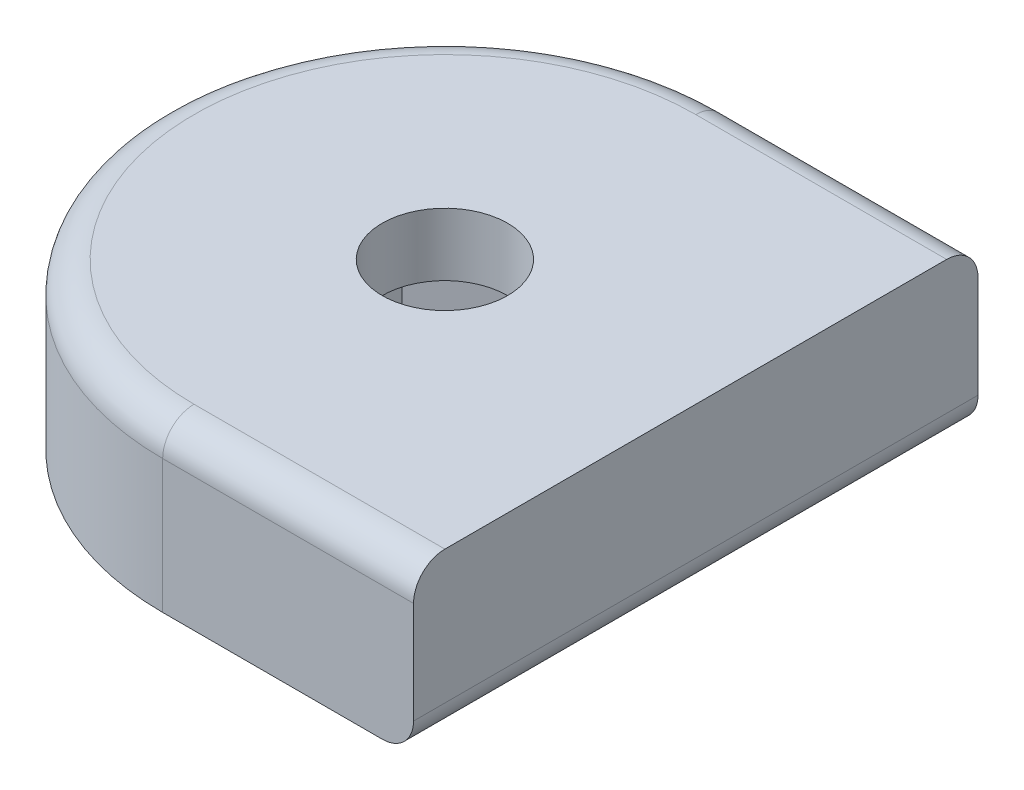
from build123d import *

# Parameters (mm, degrees)
BOSS_EXTRU_1_DEPTH      = 10.5
ENL_V_MAT_EXTRU_1_DEPTH = 6.5
ESQUISSE3_R             = 4
ENL_V_MAT_EXTRU_2_DEPTH = 27.272609311
CONG_1_R                = 2


with BuildPart() as part:
    # Esquisse1 → Boss.-Extru.1 (new body)
    with BuildSketch(Plane(origin=(0, 0, 0), x_dir=(1, 0, 0), z_dir=(0, 1, 0))):
        with BuildLine():
            Line((0, 18), (16, 18))
            Line((16, 18), (16, -18))
            Line((16, -18), (0, -18))
            ThreePointArc((0, -18), (-18, 0), (0, 18))
        make_face()
    extrude(amount=BOSS_EXTRU_1_DEPTH)

    # Esquisse2 → Enlèv. mat.-Extru.1 (cut)
    with BuildSketch(Plane(origin=(0, 0, 0), x_dir=(1, 0, 0), z_dir=(0, 1, 0))):
        Polygon((0, -7.505553499), (6.5, -3.75277675), (6.5, 3.75277675), (0, 7.505553499), (-6.5, 3.75277675), (-6.5, -3.75277675), align=None)
    extrude(amount=ENL_V_MAT_EXTRU_1_DEPTH, mode=Mode.SUBTRACT)

    # Esquisse3 → Enlèv. mat.-Extru.2 (cut, through all)
    with BuildSketch(Plane(origin=(0, 6.5, 0), x_dir=(-1, 0, 0), z_dir=(0, -1, 0))):
        with Locations(Location((0, 0, 0), (0, 0, 90))):
            Circle(ESQUISSE3_R)
    extrude(amount=-ENL_V_MAT_EXTRU_2_DEPTH, mode=Mode.SUBTRACT)

    # Congé1
    cong_1_edges = [part.edges().sort_by_distance(p)[0] for p in [
        (8, 10.5, -18),
        (-18, 10.5, 0),
        (16, 0, 0),
        (8, 10.5, 18),
    ]]
    fillet(cong_1_edges, radius=CONG_1_R)


solid = part.part
